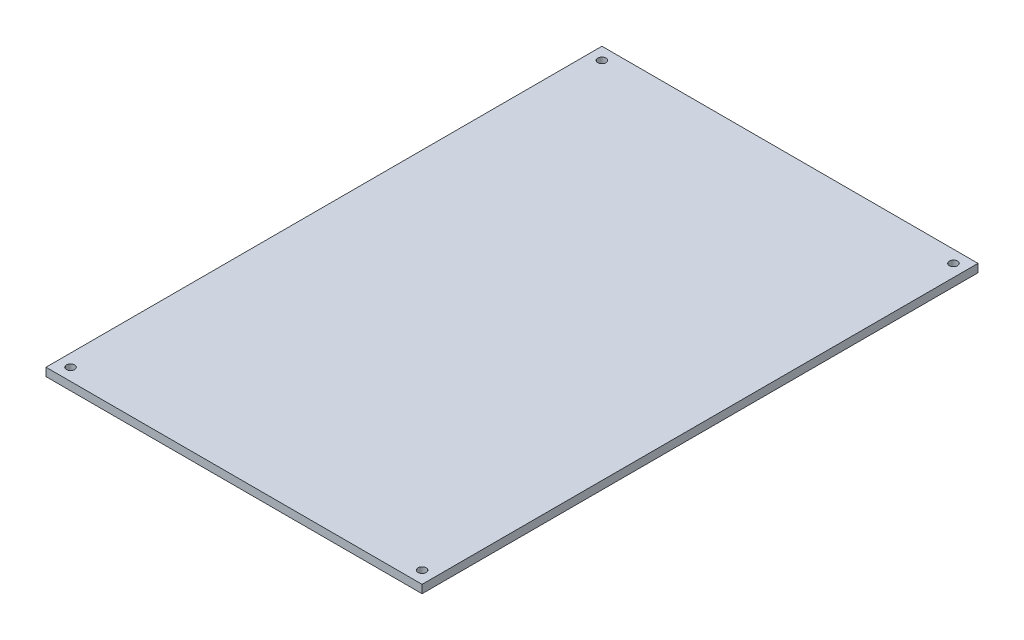
from build123d import *

# Parameters (mm, degrees)
SKETCH1_W           = 292.1
SKETCH1_H           = 431.8
SKETCH1_R           = 3.18262
BOSS_EXTRUDE1_DEPTH = 6.35


with BuildPart() as part:
    # Sketch1 → Boss-Extrude1 (new body)
    with BuildSketch(Plane(origin=(0, 0, 0), x_dir=(1, 0, 0), z_dir=(0, 1, 0))):
        Rectangle(SKETCH1_W, SKETCH1_H)
        with Locations(Location((-136.525, 206.375, 0), (0, 0, 270))):
            Circle(SKETCH1_R, mode=Mode.SUBTRACT)
        with Locations(Location((136.525, 206.375, 0), (0, 0, 270))):
            Circle(SKETCH1_R, mode=Mode.SUBTRACT)
        with Locations(Location((136.525, -206.375, 0), (0, 0, 270))):
            Circle(SKETCH1_R, mode=Mode.SUBTRACT)
        with Locations(Location((-136.525, -206.375, 0), (0, 0, 270))):
            Circle(SKETCH1_R, mode=Mode.SUBTRACT)
    extrude(amount=BOSS_EXTRUDE1_DEPTH)


solid = part.part
